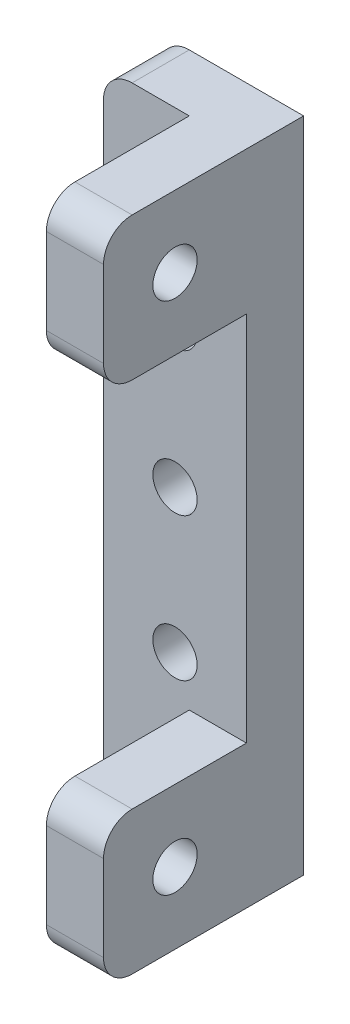
from build123d import *

# Parameters (mm, degrees)
SKETCH1_W           = 10
SKETCH1_H           = 46
SKETCH1_R           = 1.55
BOSS_EXTRUDE1_DEPTH = 4
SKETCH2_W           = 4
SKETCH2_H           = 10
BOSS_EXTRUDE2_DEPTH = 10
CUT_EXTRUDE1_REACH  = 29.586
SKETCH3_R           = 1.55
FILLET1_R           = 2


with BuildPart() as part:
    # Sketch1 → Boss-Extrude1 (new body)
    with BuildSketch(Plane.XY):
        Rectangle(SKETCH1_W, SKETCH1_H)
        with Locations((0, 10)):
            Circle(SKETCH1_R, mode=Mode.SUBTRACT)
        Circle(SKETCH1_R, mode=Mode.SUBTRACT)
        with Locations((0, -10)):
            Circle(SKETCH1_R, mode=Mode.SUBTRACT)
    extrude(amount=BOSS_EXTRUDE1_DEPTH)

    # Sketch2 → Boss-Extrude2 (add)
    with BuildSketch(Plane.XY.offset(4)):
        with Locations((3, 18)):
            Rectangle(SKETCH2_W, SKETCH2_H)
        with Locations((3, -18)):
            Rectangle(SKETCH2_W, SKETCH2_H)
    extrude(amount=BOSS_EXTRUDE2_DEPTH)

    # Sketch3 → Cut-Extrude1 (cut, up to next)
    with BuildSketch(Plane.ZY.offset(-1), mode=Mode.PRIVATE) as cut_extrude1_sk1:
        with Locations(Location((9, 18, 0), (0, 0, 270))):
            Circle(SKETCH3_R)
    cut_extrude1_tool1 = extrude(cut_extrude1_sk1.sketch, amount=-CUT_EXTRUDE1_REACH, mode=Mode.PRIVATE) & part.part
    # Sketch3 → Cut-Extrude1 (cut, up to next)
    with BuildSketch(Plane.ZY.offset(-1), mode=Mode.PRIVATE) as cut_extrude1_sk2:
        with Locations(Location((9, -18, 0), (0, 0, 270))):
            Circle(SKETCH3_R)
    cut_extrude1_tool2 = extrude(cut_extrude1_sk2.sketch, amount=-CUT_EXTRUDE1_REACH, mode=Mode.PRIVATE) & part.part
    add(cut_extrude1_tool1.solids().sort_by_distance((1, 18, 9))[0], mode=Mode.SUBTRACT)
    add(cut_extrude1_tool2.solids().sort_by_distance((1, -18, 9))[0], mode=Mode.SUBTRACT)

    # Fillet1
    fillet1_edges = [part.edges().sort_by_distance(p)[0] for p in [
        (3, 23, 14),
        (3, 13, 14),
        (3, -13, 14),
        (3, -23, 14),
        (-5, -23, 2),
        (-5, 23, 2),
    ]]
    fillet(fillet1_edges, radius=FILLET1_R)


solid = part.part
